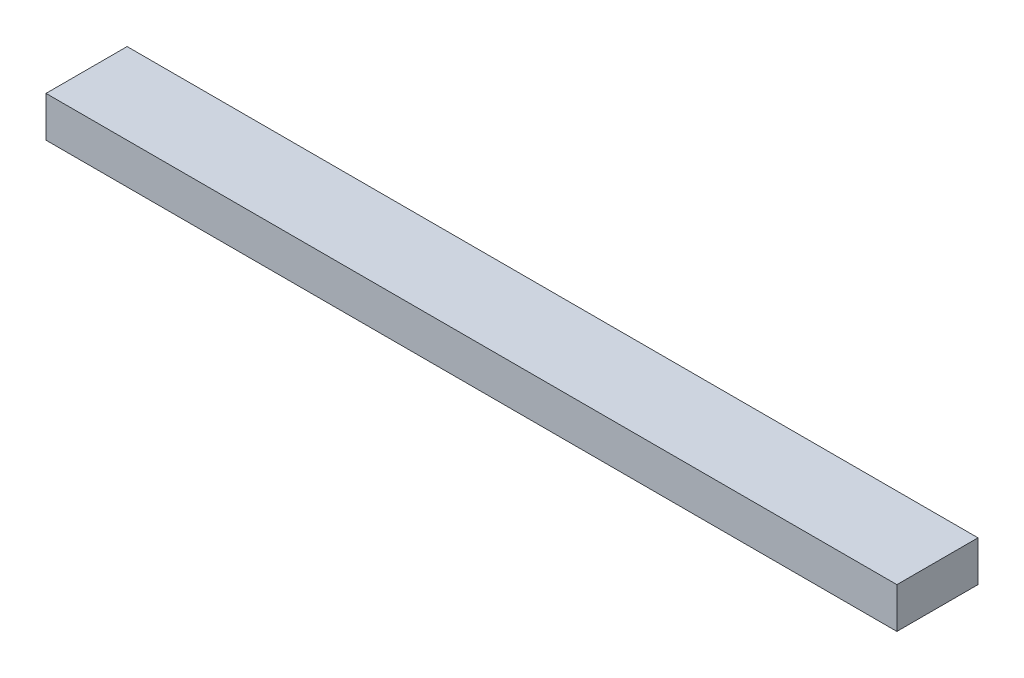
from build123d import *

# Parameters (mm, degrees)
SKETCH_1_W      = 104.91
SKETCH_1_H      = 10
EXTRUDE_1_DEPTH = 5


with BuildPart() as part:
    # 草图1 → 凸台-拉伸1 (new body)
    with BuildSketch(Plane(origin=(0, 0, 0), x_dir=(1, 0, 0), z_dir=(0, 1, 0))):
        with Locations((52.455, -5)):
            Rectangle(SKETCH_1_W, SKETCH_1_H)
    extrude(amount=EXTRUDE_1_DEPTH)


solid = part.part
